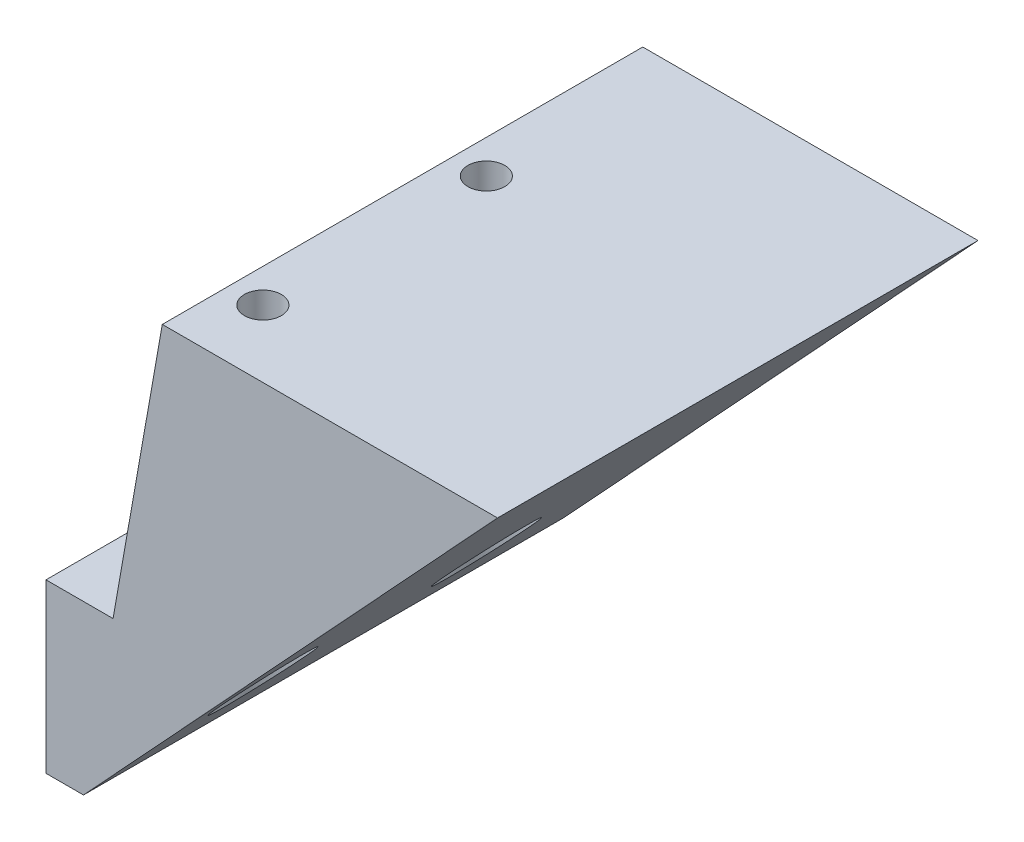
from build123d import *

# Parameters (mm, degrees)
EXTRUDE_1_DEPTH     = 43
SKETCH_2_R          = 1.65
CUT_EXTRUDE_1_DEPTH = 40
EXTRUDE_2_DEPTH     = 43
SKETCH_4_R          = 3.5
CUT_EXTRUDE_2_DEPTH = 15


with BuildPart() as part:
    # 草图1 → 凸台-拉伸1 (new body)
    with BuildSketch(Plane.XY):
        Polygon((0, 0), (7.053079228, 40), (37.053079228, 40), align=None)
    extrude(amount=EXTRUDE_1_DEPTH)

    # 草图2 → 切除-拉伸1 (cut)
    with BuildSketch(Plane(origin=(0, 40, 0), x_dir=(1, 0, 0), z_dir=(0, 1, 0))):
        with Locations(Location((10.053079228, -17, 0), (0, 0, 180))):
            Circle(SKETCH_2_R)
        with Locations(Location((10.053079228, -37, 0), (0, 0, 180))):
            Circle(SKETCH_2_R)
    extrude(amount=-CUT_EXTRUDE_1_DEPTH, mode=Mode.SUBTRACT)

    # 草图3 → 凸台-拉伸2 (add)
    with BuildSketch(Plane.XY.offset(43)):
        Polygon((2.644904711, 15), (-3.355095289, 15), (-3.355095289, 0), (0, 0), align=None)
    extrude(amount=-EXTRUDE_2_DEPTH)

    # 草图4 → 切除-拉伸2 (cut)
    with BuildSketch(Plane.XZ):
        with Locations(Location((10.053079228, 37, 0), (0, 0, 270))):
            Circle(SKETCH_4_R)
        with Locations(Location((10.053079228, 17, 0), (0, 0, 270))):
            Circle(SKETCH_4_R)
    extrude(amount=-CUT_EXTRUDE_2_DEPTH, mode=Mode.SUBTRACT)


solid = part.part
